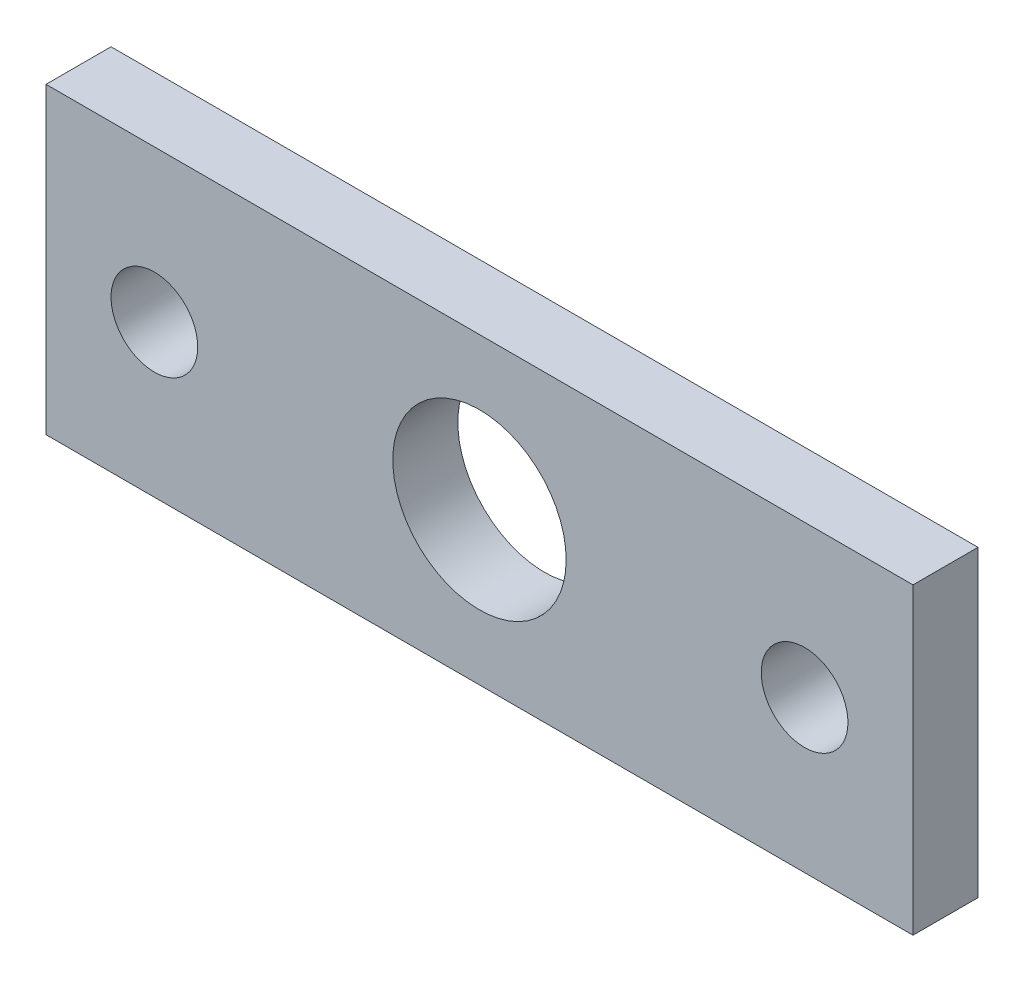
from build123d import *

# Parameters (mm, degrees)
SKETCH1_W           = 40
SKETCH1_H           = 14
SKETCH1_R           = 2
SKETCH1_R_2         = 4
BOSS_EXTRUDE1_DEPTH = 3


with BuildPart() as part:
    # Sketch1 → Boss-Extrude1 (new body)
    with BuildSketch(Plane.XY):
        with Locations((-60, -25)):
            Rectangle(SKETCH1_W, SKETCH1_H)
        with Locations((-45, -25)):
            Circle(SKETCH1_R, mode=Mode.SUBTRACT)
        with Locations((-75, -25)):
            Circle(SKETCH1_R, mode=Mode.SUBTRACT)
        with Locations((-60, -25)):
            Circle(SKETCH1_R_2, mode=Mode.SUBTRACT)
    extrude(amount=BOSS_EXTRUDE1_DEPTH)


solid = part.part
